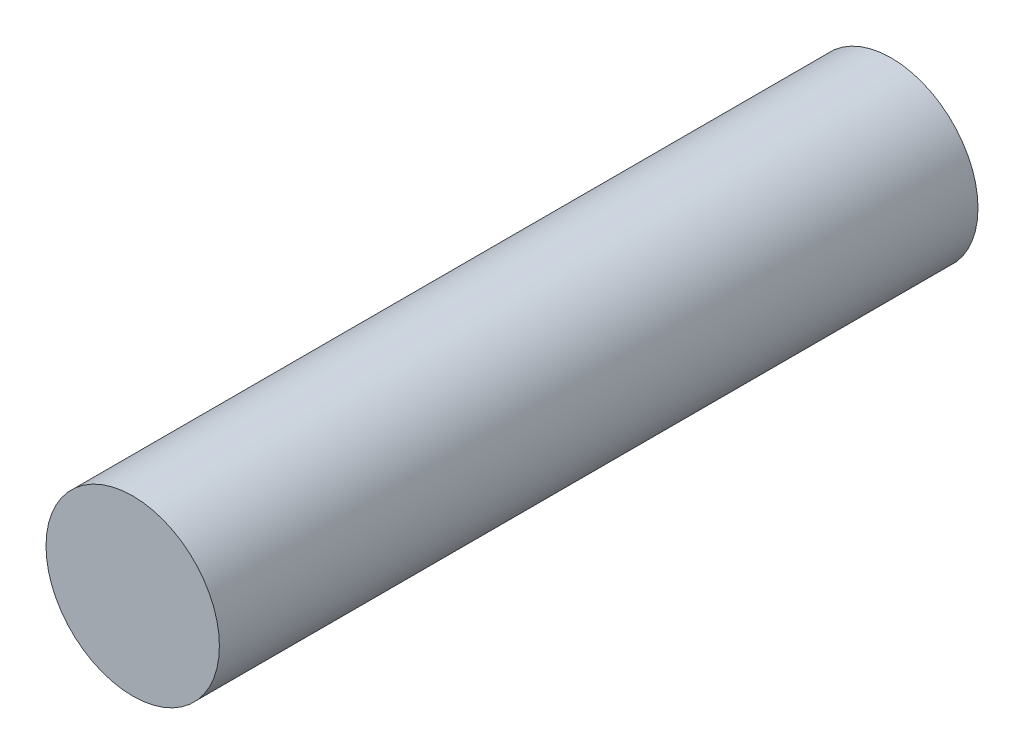
from build123d import *

# Parameters (mm, degrees)
SKETCH1_W = 4
SKETCH1_H = 35


with BuildPart() as part:
    # Sketch1 → Revolve1 (revolve)
    with BuildSketch(Plane(origin=(0, 0, 0), x_dir=(1, 0, 0), z_dir=(0, 1, 0))):
        with Locations((2, 17.5)):
            Rectangle(SKETCH1_W, SKETCH1_H)
    revolve(axis=Axis((0, 0, 0), (0, 0, -1)))


solid = part.part
